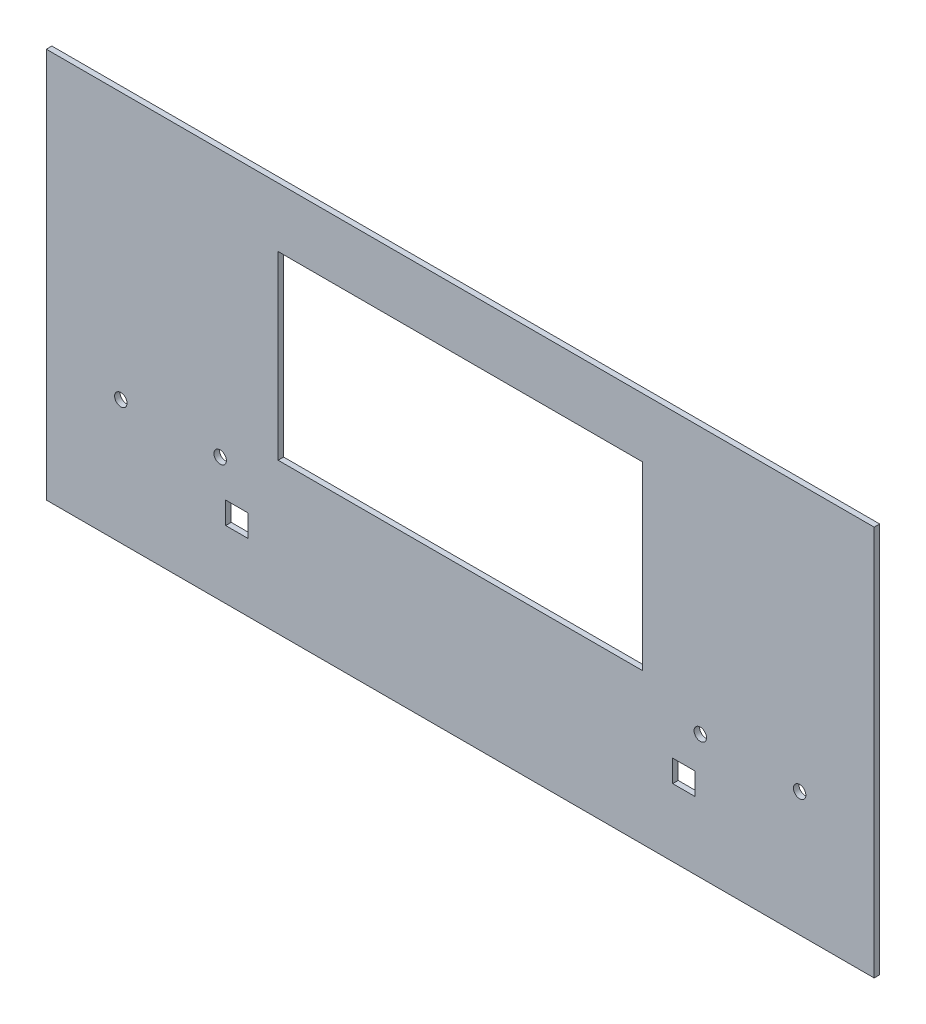
from build123d import *

# Parameters (mm, degrees)
SK_PANEL_W              = 300
SK_PANEL_H              = 141.5
EX_PANEL_DEPTH          = 2
SK_DRAWEROPENING_W      = 132
SK_DRAWEROPENING_H      = 65.5
CUT_DRAWEROPENING_DEPTH = 2
SK_CLIFFBOLTS_R         = 2.25
CUT_CLIFFBOLTS_DEPTH    = 2
SK_CLIFFCABLES_W        = 8
SK_CLIFFCABLES_H        = 8
CUT_CLIFFCABLES_DEPTH   = 2


with BuildPart() as part:
    # SK_Panel → EX_Panel (new body)
    with BuildSketch(Plane.XY):
        with Locations((0, 70.75)):
            Rectangle(SK_PANEL_W, SK_PANEL_H)
    extrude(amount=EX_PANEL_DEPTH)

    # SK_DrawerOpening → CUT_DrawerOpening (cut)
    with BuildSketch(Plane.XY):
        with Locations((0, 87.25)):
            Rectangle(SK_DRAWEROPENING_W, SK_DRAWEROPENING_H)
    extrude(amount=CUT_DRAWEROPENING_DEPTH, mode=Mode.SUBTRACT)

    # SK_CliffBolts → CUT_CliffBolts (cut)
    with BuildSketch(Plane.XY):
        with Locations((123, 45)):
            Circle(SK_CLIFFBOLTS_R)
        with Locations((87, 45)):
            Circle(SK_CLIFFBOLTS_R)
        with Locations((-123, 45)):
            Circle(SK_CLIFFBOLTS_R)
        with Locations((-87, 45)):
            Circle(SK_CLIFFBOLTS_R)
    extrude(amount=CUT_CLIFFBOLTS_DEPTH, mode=Mode.SUBTRACT)

    # SK_CliffCables → CUT_CliffCables (cut)
    with BuildSketch(Plane.XY):
        with Locations((81, 28.5)):
            Rectangle(SK_CLIFFCABLES_W, SK_CLIFFCABLES_H)
        with Locations((-81, 28.5)):
            Rectangle(SK_CLIFFCABLES_W, SK_CLIFFCABLES_H)
    extrude(amount=CUT_CLIFFCABLES_DEPTH, mode=Mode.SUBTRACT)


solid = part.part
